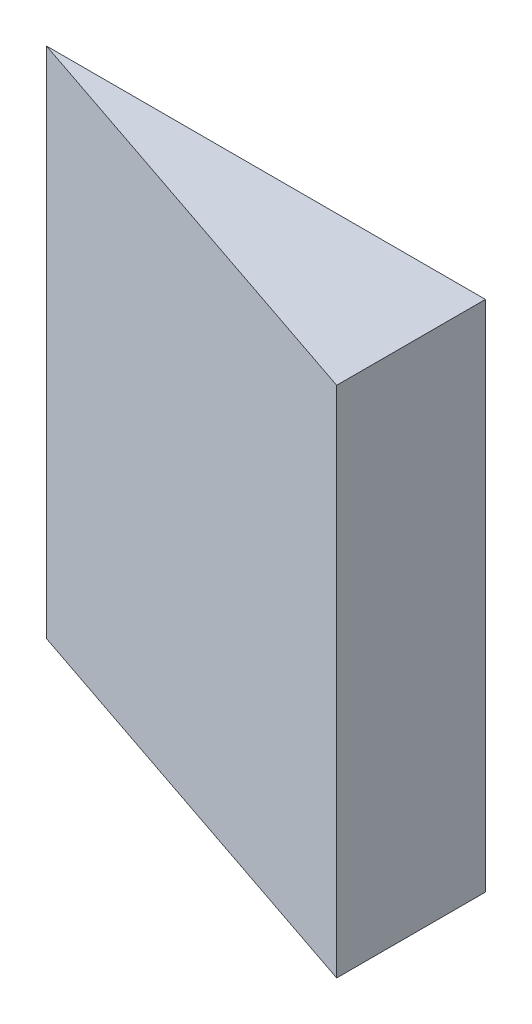
from build123d import *

# Parameters (mm, degrees)
BOSS_EXTRUDE1_DEPTH = 87.63


with BuildPart() as part:
    # Sketch1 → Boss-Extrude1 (new body)
    with BuildSketch(Plane(origin=(0, 0, 0), x_dir=(1, 0, 0), z_dir=(0, 1, 0))):
        Polygon((-9.902883232, 34.190845126), (65.027116768, 34.190845126), (65.027116768, 8.790845126), align=None)
    extrude(amount=BOSS_EXTRUDE1_DEPTH)


solid = part.part
